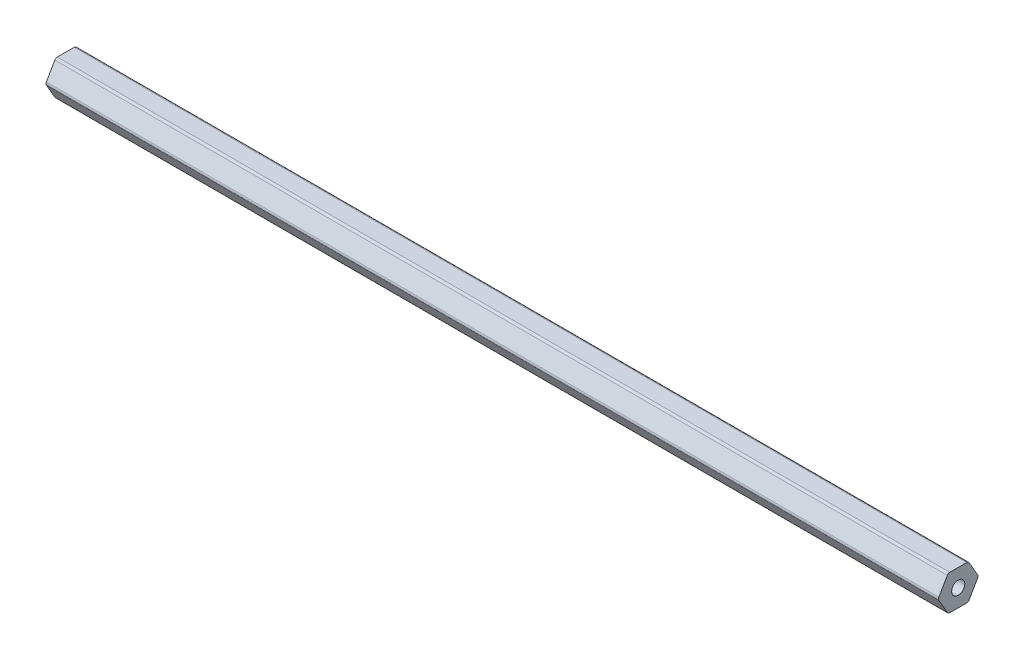
from build123d import *

# Parameters (mm, degrees)
SKETCH1_R           = 2.38125
BOSS_EXTRUDE1_DEPTH = 323.85


with BuildPart() as part:
    # Sketch1 → Boss-Extrude1 (new body)
    with BuildSketch(Plane(origin=(0, 0, 0), x_dir=(0, 0, -1), z_dir=(1, 0, 0))):
        with BuildLine():
            Line((7.039054482, 0.508), (3.959468146, 5.842))
            ThreePointArc((3.959468146, 5.842), (3.587586336, 6.21388181), (3.079586336, 6.35))
            Line((3.079586336, 6.35), (-3.079586336, 6.35))
            ThreePointArc((-3.079586336, 6.35), (-3.587586336, 6.21388181), (-3.959468146, 5.842))
            Line((-3.959468146, 5.842), (-7.039054482, 0.508))
            ThreePointArc((-7.039054482, 0.508), (-7.175172672, 0), (-7.039054482, -0.508))
            Line((-7.039054482, -0.508), (-3.959468146, -5.842))
            ThreePointArc((-3.959468146, -5.842), (-3.587586336, -6.21388181), (-3.079586336, -6.35))
            Line((-3.079586336, -6.35), (3.079586336, -6.35))
            ThreePointArc((3.079586336, -6.35), (3.587586336, -6.21388181), (3.959468146, -5.842))
            Line((3.959468146, -5.842), (7.039054482, -0.508))
            ThreePointArc((7.039054482, -0.508), (7.175172672, 0), (7.039054482, 0.508))
        make_face()
        Circle(SKETCH1_R, mode=Mode.SUBTRACT)
    extrude(amount=BOSS_EXTRUDE1_DEPTH)


solid = part.part
